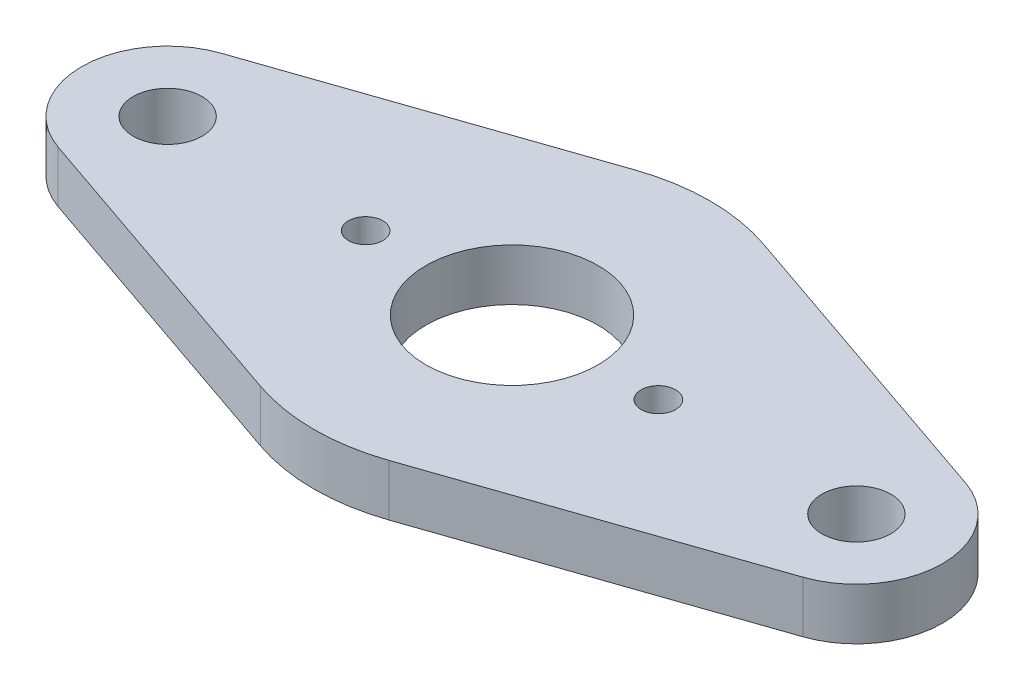
from build123d import *

# Parameters (mm, degrees)
SKETCH1_R           = 2
SKETCH1_R_2         = 1
SKETCH1_R_3         = 5
BOSS_EXTRUDE1_DEPTH = 3


with BuildPart() as part:
    # Sketch1 → Boss-Extrude1 (new body)
    with BuildSketch(Plane(origin=(0, 0, 0), x_dir=(1, 0, 0), z_dir=(0, 1, 0))):
        with BuildLine():
            Line((-21.625, 4.72857008), (-3.7375, 10.875711184))
            ThreePointArc((-3.7375, 10.875711184), (0, 11.5), (3.7375, 10.875711184))
            Line((3.7375, 10.875711184), (21.625, 4.72857008))
            ThreePointArc((21.625, 4.72857008), (25, 0), (21.625, -4.72857008))
            Line((21.625, -4.72857008), (3.7375, -10.875711184))
            ThreePointArc((3.7375, -10.875711184), (0, -11.5), (-3.7375, -10.875711184))
            Line((-3.7375, -10.875711184), (-21.625, -4.72857008))
            ThreePointArc((-21.625, -4.72857008), (-25, 0), (-21.625, 4.72857008))
        make_face()
        with Locations(Location((-20, 0, 0), (0, 0, 270))):
            Circle(SKETCH1_R, mode=Mode.SUBTRACT)
        with Locations(Location((-8.5, 0, 0), (0, 0, 270))):
            Circle(SKETCH1_R_2, mode=Mode.SUBTRACT)
        with Locations(Location((8.5, 0, 0), (0, 0, 90))):
            Circle(SKETCH1_R_2, mode=Mode.SUBTRACT)
        with Locations(Location((20, 0, 0), (0, 0, 90))):
            Circle(SKETCH1_R, mode=Mode.SUBTRACT)
        with Locations(Location((0, 0, 0), (0, 0, 270))):
            Circle(SKETCH1_R_3, mode=Mode.SUBTRACT)
    extrude(amount=BOSS_EXTRUDE1_DEPTH)


solid = part.part
